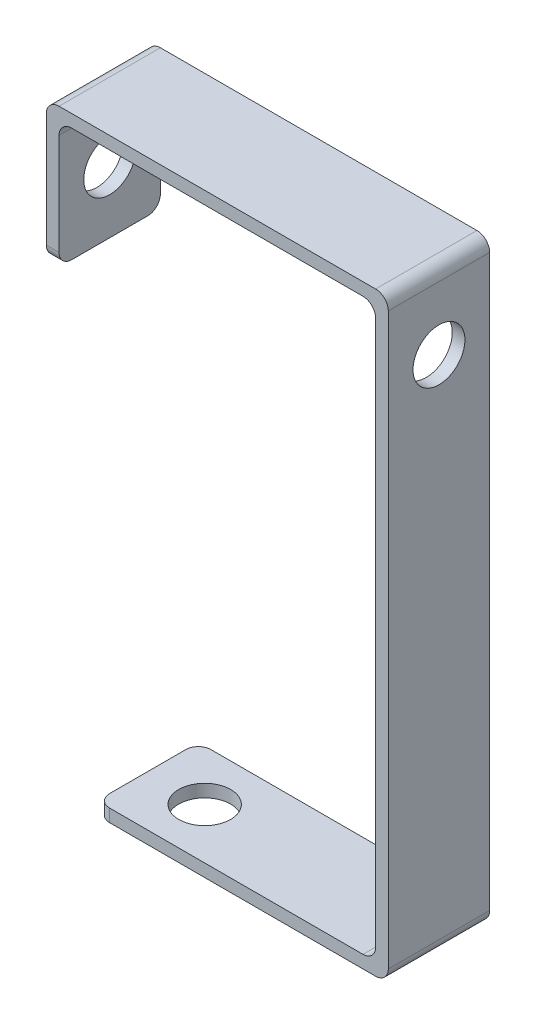
from build123d import *

# Parameters (mm, degrees)
EXTRUDE_1_DEPTH     = 4
SKETCH_2_R          = 2.05
CUT_EXTRUDE_1_DEPTH = 55.350712967
SKETCH_3_R          = 2.05
CUT_EXTRUDE_2_DEPTH = 54.488316481
FILLET_1_R          = 1
FILLET_2_R          = 1
FILLET_3_R          = 1


with BuildPart() as part:
    # 草图1 → 拉伸-薄壁1 (new, symmetric)
    with BuildSketch(Plane.XY):
        Polygon((-27, -11), (-27, 0), (0, 0), (0, -47), (-23, -47), (-23, -46), (-1, -46), (-1, -1), (-26, -1), (-26, -11), align=None)
    extrude(amount=EXTRUDE_1_DEPTH, both=True)

    # 草图2 → 切除-拉伸1 (cut, through all)
    with BuildSketch(Plane(origin=(0, 0, 0), x_dir=(0, 0, -1), z_dir=(1, 0, 0))):
        with Locations(Location((0, -6, 0), (0, 0, 90))):
            Circle(SKETCH_2_R)
    extrude(amount=-CUT_EXTRUDE_1_DEPTH, mode=Mode.SUBTRACT)

    # 草图3 → 切除-拉伸2 (cut, through all)
    with BuildSketch(Plane(origin=(0, -46, 0), x_dir=(1, 0, 0), z_dir=(0, 1, 0))):
        with Locations(Location((-18.5, 0, 0), (0, 0, 270))):
            Circle(SKETCH_3_R)
    extrude(amount=-CUT_EXTRUDE_2_DEPTH, mode=Mode.SUBTRACT)

    # 圆角1
    fillet_1_edges = [part.edges().sort_by_distance(p)[0] for p in [
        (-23, -46.5, -4),
        (-26.5, -11, 4),
        (-23, -46.5, 4),
        (-26.5, -11, -4),
    ]]
    fillet(fillet_1_edges, radius=FILLET_1_R)

    # 圆角2
    fillet_2_edges = [part.edges().sort_by_distance(p)[0] for p in [
        (-1, -46, 0),
        (-1, -1, 0),
        (0, 0, 0),
        (0, -47, 0),
    ]]
    fillet(fillet_2_edges, radius=FILLET_2_R)

    # 圆角3
    fillet_3_edges = [part.edges().sort_by_distance(p)[0] for p in [
        (-26, -1, 0),
        (-27, 0, 0),
    ]]
    fillet(fillet_3_edges, radius=FILLET_3_R)


solid = part.part
